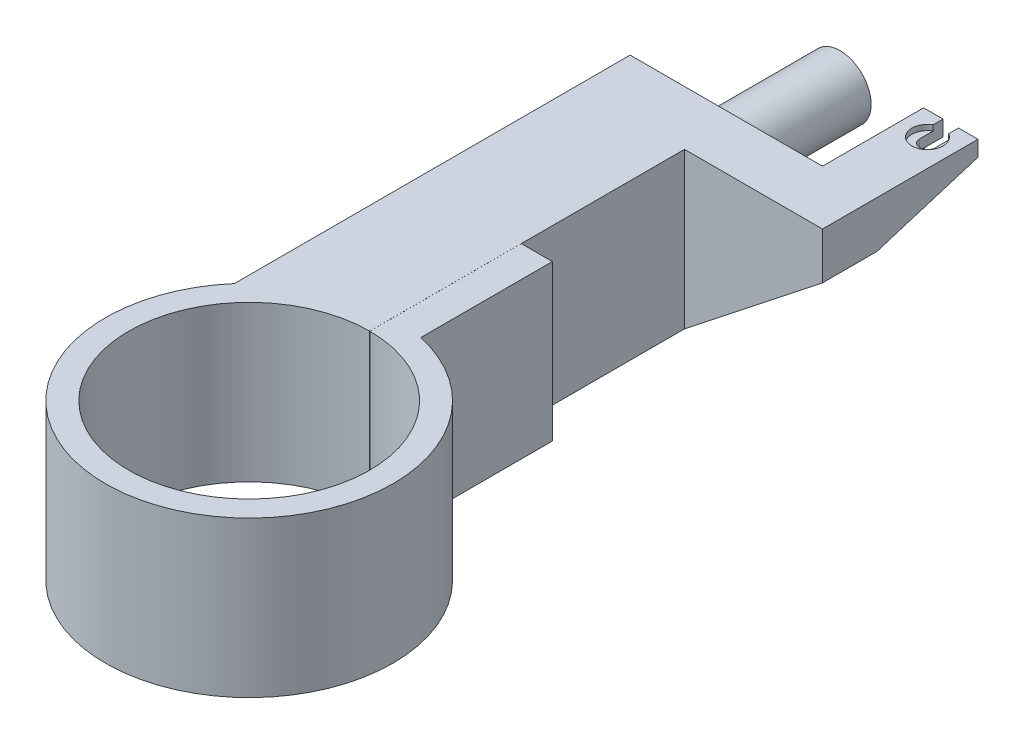
from build123d import *

# Parameters (mm, degrees)
BOSS_EXTRUDE1_DEPTH = 20
SKETCH2_R           = 4
BOSS_EXTRUDE2_DEPTH = 20
BOSS_EXTRUDE3_DEPTH = 2
BOSS_EXTRUDE4_DEPTH = 18
CUT_EXTRUDE1_DEPTH  = 22
BOSS_EXTRUDE5_DEPTH = 2
SKETCH8_R           = 2
CUT_EXTRUDE3_DEPTH  = 0.7
CUT_EXTRUDE2_REACH  = 94.752
SKETCH6_W           = 19.696996452
SKETCH6_H           = 13.58493718
CUT_EXTRUDE4_REACH  = 94.752
BOSS_EXTRUDE6_START = -2
BOSS_EXTRUDE6_DEPTH = 2
BOSS_EXTRUDE7_DEPTH = 2
BOSS_EXTRUDE8_START = -20
BOSS_EXTRUDE8_DEPTH = 20
SKETCH14_W          = 110.253252585
SKETCH14_H          = 65.190024071
CUT_EXTRUDE5_DEPTH  = 159


with BuildPart() as part:
    # Sketch1 → Boss-Extrude1 (new body)
    with BuildSketch(Plane(origin=(0, 0, 0), x_dir=(1, 0, 0), z_dir=(0, 1, 0))):
        with BuildLine():
            Line((0, -15.5), (0, -63))
            Line((0, -63), (-14, -63))
            Line((-14, -63), (-14, -12.093386622))
            ThreePointArc((-14, -12.093386622), (-16.822271733, 7.698127938), (0, 18.5))
            Line((0, 18.5), (0, 15.5))
            ThreePointArc((0, 15.5), (-15.5, 0), (0, -15.5))
        make_face()
        with BuildLine():
            Line((-11, -60), (-11, -14.874474781))
            ThreePointArc((-11, -14.874474781), (-7.201195596, -17.04091494), (-3, -18.255136264))
            Line((-3, -18.255136264), (-3, -60))
            Line((-3, -60), (-11, -60))
        make_face(mode=Mode.SUBTRACT)
    extrude(amount=BOSS_EXTRUDE1_DEPTH)

    # Sketch2 → Boss-Extrude2 (add)
    with BuildSketch(Plane.XY.offset(63)):
        with Locations(Location((-7, 10, 0), (0, 0, 180))):
            Circle(SKETCH2_R)
    extrude(amount=BOSS_EXTRUDE2_DEPTH)

    # Sketch3 → Boss-Extrude3 (add)
    with BuildSketch(Plane(origin=(0, 20, 0), x_dir=(1, 0, 0), z_dir=(0, 1, 0))):
        with BuildLine():
            Line((0, -63), (10.749394376, -63))
            Line((10.749394376, -63), (10.749394376, -76))
            Line((10.749394376, -76), (13.249394376, -76))
            Line((13.249394376, -76), (13.249394376, -73))
            ThreePointArc((13.249394376, -73), (14.249394376, -72), (15.249394376, -73))
            Line((15.249394376, -73), (15.249394376, -76))
            Line((15.249394376, -76), (17.749394376, -76))
            Line((17.749394376, -76), (17.749394376, -56))
            Line((17.749394376, -56), (0, -56))
            Line((0, -56), (0, -63))
        make_face()
        Polygon((2, -58), (15.749394376, -58), (15.749394376, -69), (12.749394376, -69), (12.749394376, -61), (2, -61), align=None, mode=Mode.SUBTRACT)
    extrude(amount=-BOSS_EXTRUDE3_DEPTH)

    # Sketch4 → Boss-Extrude4 (add)
    with BuildSketch(Plane.XZ.offset(-18)):
        Polygon((15.749394376, 69), (15.749394376, 58), (2, 58), (2, 61), (12.749394376, 61), (12.749394376, 69), (12.749394376, 76), (10.749394376, 76), (10.749394376, 66), (10.749394376, 63), (0, 63), (0, 56), (17.749394376, 56), (17.749394376, 66), (17.749394376, 76), (15.749394376, 76), align=None)
    extrude(amount=BOSS_EXTRUDE4_DEPTH)

    # Sketch5 → Cut-Extrude1 (cut)
    with BuildSketch(Plane(origin=(0, 0, 56), x_dir=(-1, 0, 0), z_dir=(0, 0, -1))):
        Polygon((0, 0), (-17.749394376, 14), (-17.749394376, -1.554529852), (0, -1.554529852), align=None)
    extrude(amount=-CUT_EXTRUDE1_DEPTH, mode=Mode.SUBTRACT)

    # Sketch7 → Boss-Extrude5 (add)
    with BuildSketch(Plane(origin=(0, 20, 0), x_dir=(1, 0, 0), z_dir=(0, 1, 0))):
        Polygon((2, -61), (12.749394376, -61), (12.749394376, -69), (15.749394376, -69), (15.749394376, -58), (2, -58), align=None)
    extrude(amount=-BOSS_EXTRUDE5_DEPTH)

    # Sketch8 → Cut-Extrude3 (cut)
    with BuildSketch(Plane(origin=(0, 20, 0), x_dir=(1, 0, 0), z_dir=(0, 1, 0))):
        with Locations((14.249394376, -73)):
            Circle(SKETCH8_R)
    extrude(amount=-CUT_EXTRUDE3_DEPTH, mode=Mode.SUBTRACT)

    # Cut-Extrude2: up to this face of the body (flat: up to its plane)
    cut_extrude2_end = Plane(part.part.faces().sort_by_distance((10.749394376, 14.239342427, 69.5))[0])
    # Sketch6 → Cut-Extrude2 (cut, up to the picked face)
    with BuildSketch(Plane(origin=(17.749394376, 0, 0), x_dir=(0, 0, -1), z_dir=(1, 0, 0)), mode=Mode.PRIVATE) as cut_extrude2_sk1:
        with Locations((-72.848498226, 7.20753141)):
            Rectangle(SKETCH6_W, SKETCH6_H)
    cut_extrude2_tool1 = split(extrude(cut_extrude2_sk1.sketch, amount=-CUT_EXTRUDE2_REACH, mode=Mode.PRIVATE), bisect_by=cut_extrude2_end, keep=Keep.BOTH, mode=Mode.PRIVATE)
    add(cut_extrude2_tool1.solids().sort_by(Axis((17.749394, 7.207531, 72.848498), (-1, 0, 0)))[0], mode=Mode.SUBTRACT)

    # Cut-Extrude4: up to this face of the body (flat: up to its plane)
    cut_extrude4_end = Plane(part.part.faces().sort_by_distance((10.749394376, 17, 69.5))[0])
    # Sketch10 → Cut-Extrude4 (cut, up to the picked face)
    with BuildSketch(Plane(origin=(17.749394376, 0, 0), x_dir=(0, 0, -1), z_dir=(1, 0, 0)), mode=Mode.PRIVATE) as cut_extrude4_sk1:
        Polygon((-63, 14), (-76, 18), (-76, 12.216867542), (-63, 12.216867542), align=None)
    cut_extrude4_tool1 = split(extrude(cut_extrude4_sk1.sketch, amount=-CUT_EXTRUDE4_REACH, mode=Mode.PRIVATE), bisect_by=cut_extrude4_end, keep=Keep.BOTH, mode=Mode.PRIVATE)
    add(cut_extrude4_tool1.solids().sort_by(Axis((17.749394, 14.284655, 70.645435), (-1, 0, 0)))[0], mode=Mode.SUBTRACT)

    # Sketch11 → Boss-Extrude6 (add)
    with BuildSketch(Plane(origin=(0, 20, 0), x_dir=(1, 0, 0), z_dir=(0, 1, 0)).offset(BOSS_EXTRUDE6_START)):
        with BuildLine():
            Line((-11, -14.874474781), (-11, -60))
            Line((-11, -60), (-3, -60))
            Line((-3, -60), (-3, -18.255136264))
            ThreePointArc((-3, -18.255136264), (-7.201195596, -17.04091494), (-11, -14.874474781))
        make_face()
    extrude(amount=BOSS_EXTRUDE6_DEPTH)

    # Sketch12 → Boss-Extrude7 (add)
    with BuildSketch(Plane.XZ):
        with BuildLine():
            Line((-3, 60), (-3, 18.255136264))
            ThreePointArc((-3, 18.255136264), (-7.201195596, 17.04091494), (-11, 14.874474781))
            Line((-11, 14.874474781), (-11, 60))
            Line((-11, 60), (-3, 60))
        make_face()
    extrude(amount=-BOSS_EXTRUDE7_DEPTH)

    # Sketch13 → Boss-Extrude8 (add)
    with BuildSketch(Plane(origin=(0, 20, 0), x_dir=(1, 0, 0), z_dir=(0, 1, 0)).offset(BOSS_EXTRUDE8_START)):
        with BuildLine():
            Line((0, 15.5), (0, 18.5))
            ThreePointArc((0, 18.5), (18.390272559, 2.011933204), (4, -18.062391868))
            Line((4, -18.062391868), (4, -35))
            Line((4, -35), (0.01, -35))
            Line((0.01, -35), (0.01, -15.499996774))
            ThreePointArc((0.01, -15.499996774), (15.499999194, 0.005), (0, 15.5))
        make_face()
    extrude(amount=BOSS_EXTRUDE8_DEPTH)

    # Mirror2: part across plane


with BuildPart() as part_1:
    add(part.part)
    add(part.part.mirror(Plane.XY.offset(83)))

    # Sketch14 → Cut-Extrude5 (cut)
    with BuildSketch(Plane.XY.offset(83)):
        with Locations((-0.228844539, 6.918373918)):
            Rectangle(SKETCH14_W, SKETCH14_H)
    extrude(amount=-CUT_EXTRUDE5_DEPTH, mode=Mode.SUBTRACT)


solid = part_1.part
